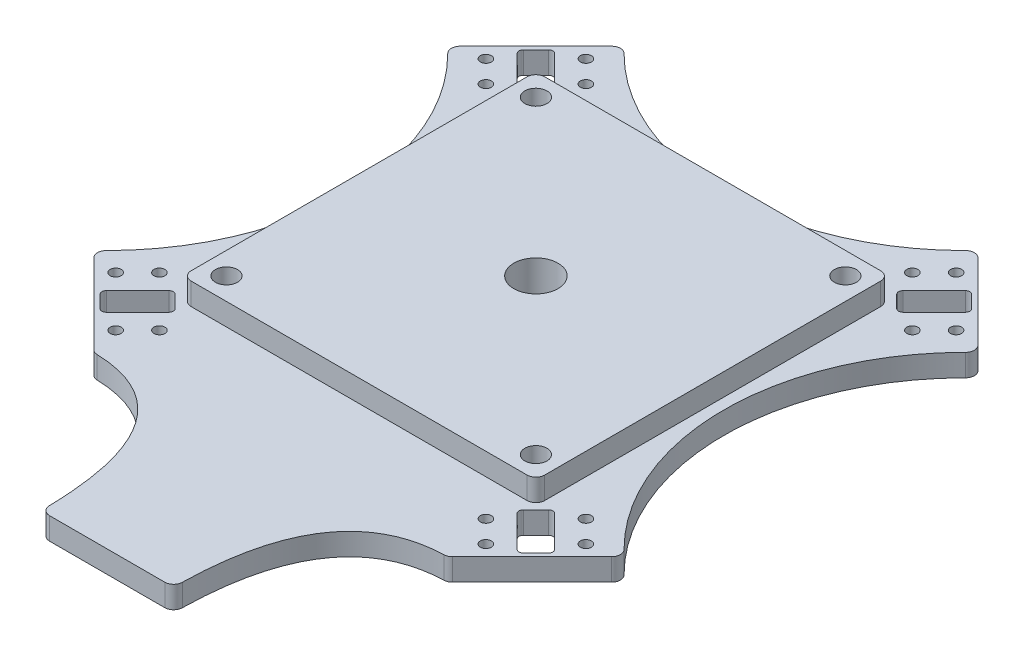
from build123d import *

# Parameters (mm, degrees)
BOSS_EXTRUDE1_DEPTH     = 5
SKETCH4_W               = 80
SKETCH4_H               = 80
BOSS_EXTRUDE2_DEPTH     = 5
CUT_EXTRUDE4_DEPTH      = 5
CUT_EXTRUDE4_DEPTH_BACK = 5
SKETCH6_R               = 2.5
SKETCH7_R               = 1.25
CUT_EXTRUDE5_DEPTH      = 5
SKETCH8_R               = 5
CUT_EXTRUDE6_DEPTH      = 10
BOSS_EXTRUDE3_START     = -5
BOSS_EXTRUDE3_DEPTH     = 5
FILLET1_R               = 2
FILLET2_R               = 2


with BuildPart() as part:
    # Sketch3 → Boss-Extrude1 (new body)
    with BuildSketch(Plane(origin=(0, 0, 0), x_dir=(1, 0, 0), z_dir=(0, 1, 0))):
        with BuildLine():
            Line((-60, 40), (-40, 60))
            ThreePointArc((-40, 60), (0, 42.5), (40, 60))
            Line((40, 60), (60, 40))
            ThreePointArc((60, 40), (42.5, 0), (60, -40))
            Line((60, -40), (40, -60))
            ThreePointArc((40, -60), (0, -42.5), (-40, -60))
            Line((-40, -60), (-60, -40))
            ThreePointArc((-60, -40), (-42.5, 0), (-60, 40))
        make_face()
    extrude(amount=BOSS_EXTRUDE1_DEPTH)

    # Sketch4 → Boss-Extrude2 (add)
    with BuildSketch(Plane(origin=(0, 5, 0), x_dir=(1, 0, 0), z_dir=(0, 1, 0))):
        Rectangle(SKETCH4_W, SKETCH4_H)
    extrude(amount=BOSS_EXTRUDE2_DEPTH)

    # Sketch6 → Cut-Extrude4 (cut, two sides: drawn at the far end of the back side and taken through both)
    with BuildSketch(Plane(origin=(0, 5, 0), x_dir=(1, 0, 0), z_dir=(0, 1, 0)).offset(-CUT_EXTRUDE4_DEPTH_BACK)):
        with Locations((-35, 35)):
            Circle(SKETCH6_R)
        with Locations((35, 35)):
            Circle(SKETCH6_R)
        with Locations((35, -35)):
            Circle(SKETCH6_R)
        with Locations((-35, -35)):
            Circle(SKETCH6_R)
    extrude(amount=CUT_EXTRUDE4_DEPTH + CUT_EXTRUDE4_DEPTH_BACK, mode=Mode.SUBTRACT)

    # Sketch7 → Cut-Extrude5 (cut)
    with BuildSketch(Plane(origin=(0, 5, 0), x_dir=(1, 0, 0), z_dir=(0, 1, 0))):
        with BuildLine():
            Line((-47.878679656, 50.707106781), (-50.707106781, 47.878679656))
            ThreePointArc((-50.707106781, 47.878679656), (-51, 47.171572875), (-50.707106781, 46.464466094))
            Line((-50.707106781, 46.464466094), (-43.636038969, 39.393398282))
            ThreePointArc((-43.636038969, 39.393398282), (-42.928932188, 39.100505063), (-42.221825407, 39.393398282))
            Line((-42.221825407, 39.393398282), (-39.393398282, 42.221825407))
            ThreePointArc((-39.393398282, 42.221825407), (-39.100505063, 42.928932188), (-39.393398282, 43.636038969))
            Line((-39.393398282, 43.636038969), (-46.464466094, 50.707106781))
            ThreePointArc((-46.464466094, 50.707106781), (-47.171572875, 51), (-47.878679656, 50.707106781))
        make_face()
        with BuildLine():
            Line((39.393398282, 42.221825407), (42.221825407, 39.393398282))
            ThreePointArc((42.221825407, 39.393398282), (42.928932188, 39.100505063), (43.636038969, 39.393398282))
            Line((43.636038969, 39.393398282), (50.707106781, 46.464466094))
            ThreePointArc((50.707106781, 46.464466094), (51, 47.171572875), (50.707106781, 47.878679656))
            Line((50.707106781, 47.878679656), (47.878679656, 50.707106781))
            ThreePointArc((47.878679656, 50.707106781), (47.171572875, 51), (46.464466094, 50.707106781))
            Line((46.464466094, 50.707106781), (39.393398282, 43.636038969))
            ThreePointArc((39.393398282, 43.636038969), (39.100505063, 42.928932188), (39.393398282, 42.221825407))
        make_face()
        with BuildLine():
            Line((42.221825407, -39.393398282), (39.393398282, -42.221825407))
            ThreePointArc((39.393398282, -42.221825407), (39.100505063, -42.928932188), (39.393398282, -43.636038969))
            Line((39.393398282, -43.636038969), (46.464466094, -50.707106781))
            ThreePointArc((46.464466094, -50.707106781), (47.171572875, -51), (47.878679656, -50.707106781))
            Line((47.878679656, -50.707106781), (50.707106781, -47.878679656))
            ThreePointArc((50.707106781, -47.878679656), (51, -47.171572875), (50.707106781, -46.464466094))
            Line((50.707106781, -46.464466094), (43.636038969, -39.393398282))
            ThreePointArc((43.636038969, -39.393398282), (42.928932188, -39.100505063), (42.221825407, -39.393398282))
        make_face()
        with BuildLine():
            Line((-39.393398282, -42.221825407), (-42.221825407, -39.393398282))
            ThreePointArc((-42.221825407, -39.393398282), (-42.928932188, -39.100505063), (-43.636038969, -39.393398282))
            Line((-43.636038969, -39.393398282), (-50.707106781, -46.464466094))
            ThreePointArc((-50.707106781, -46.464466094), (-51, -47.171572875), (-50.707106781, -47.878679656))
            Line((-50.707106781, -47.878679656), (-47.878679656, -50.707106781))
            ThreePointArc((-47.878679656, -50.707106781), (-47.171572875, -51), (-46.464466094, -50.707106781))
            Line((-46.464466094, -50.707106781), (-39.393398282, -43.636038969))
            ThreePointArc((-39.393398282, -43.636038969), (-39.100505063, -42.928932188), (-39.393398282, -42.221825407))
        make_face()
        with Locations((-41.868272016, 53.181980515)):
            Circle(SKETCH7_R)
        with Locations((-36.918524548, 48.232233047)):
            Circle(SKETCH7_R)
        with Locations((-48.232233047, 36.918524548)):
            Circle(SKETCH7_R)
        with Locations((-53.181980515, 41.868272016)):
            Circle(SKETCH7_R)
        with Locations((41.868272016, 53.181980515)):
            Circle(SKETCH7_R)
        with Locations((36.918524548, 48.232233047)):
            Circle(SKETCH7_R)
        with Locations((48.232233047, 36.918524548)):
            Circle(SKETCH7_R)
        with Locations((53.181980515, 41.868272016)):
            Circle(SKETCH7_R)
        with Locations((53.181980515, -41.868272016)):
            Circle(SKETCH7_R)
        with Locations((48.232233047, -36.918524548)):
            Circle(SKETCH7_R)
        with Locations((36.918524548, -48.232233047)):
            Circle(SKETCH7_R)
        with Locations((41.868272016, -53.181980515)):
            Circle(SKETCH7_R)
        with Locations((-41.868272016, -53.181980515)):
            Circle(SKETCH7_R)
        with Locations((-36.918524548, -48.232233047)):
            Circle(SKETCH7_R)
        with Locations((-48.232233047, -36.918524548)):
            Circle(SKETCH7_R)
        with Locations((-53.181980515, -41.868272016)):
            Circle(SKETCH7_R)
    extrude(amount=-CUT_EXTRUDE5_DEPTH, mode=Mode.SUBTRACT)

    # Sketch8 → Cut-Extrude6 (cut)
    with BuildSketch(Plane(origin=(0, 0, 0), x_dir=(1, 0, 0), z_dir=(0, 1, 0))):
        Circle(SKETCH8_R)
    extrude(amount=CUT_EXTRUDE6_DEPTH, mode=Mode.SUBTRACT)

    # Sketch9 → Boss-Extrude3 (add)
    with BuildSketch(Plane(origin=(0, 5, 0), x_dir=(1, 0, 0), z_dir=(0, 1, 0)).offset(BOSS_EXTRUDE3_START)):
        with BuildLine():
            Line((-15, -96.964285714), (15, -96.964285714))
            add(Edge.make_bspline(
                [(15, -96.964285714), (15.040974101, -60.242963076), (40, -60)],
                knots=[0, 0, 0, 1, 1, 1], degree=2))
            ThreePointArc((40, -60), (0, -42.5), (-40, -60))
            add(Edge.make_bspline(
                [(-15, -96.964285714), (-15.040974101, -60.242963076), (-40, -60)],
                knots=[0, 0, 0, 1, 1, 1], degree=2))
        make_face()
    extrude(amount=BOSS_EXTRUDE3_DEPTH)

    # Fillet1
    fillet1_edges = [part.edges().sort_by_distance(p)[0] for p in [
        (-40, 2.5, 60),
        (-60, 2.5, 40),
        (-60, 2.5, -40),
        (-40, 2.5, -60),
        (40, 2.5, -60),
        (60, 2.5, -40),
        (-15, 2.5, 96.964285714),
        (60, 2.5, 40),
        (40, 2.5, 60),
        (15, 2.5, 96.964285714),
    ]]
    fillet(fillet1_edges, radius=FILLET1_R)

    # Fillet2
    fillet2_edges = [part.edges().sort_by_distance(p)[0] for p in [
        (40, 7.5, -40),
        (40, 7.5, 40),
        (-40, 7.5, 40),
        (-40, 7.5, -40),
    ]]
    fillet(fillet2_edges, radius=FILLET2_R)


solid = part.part
